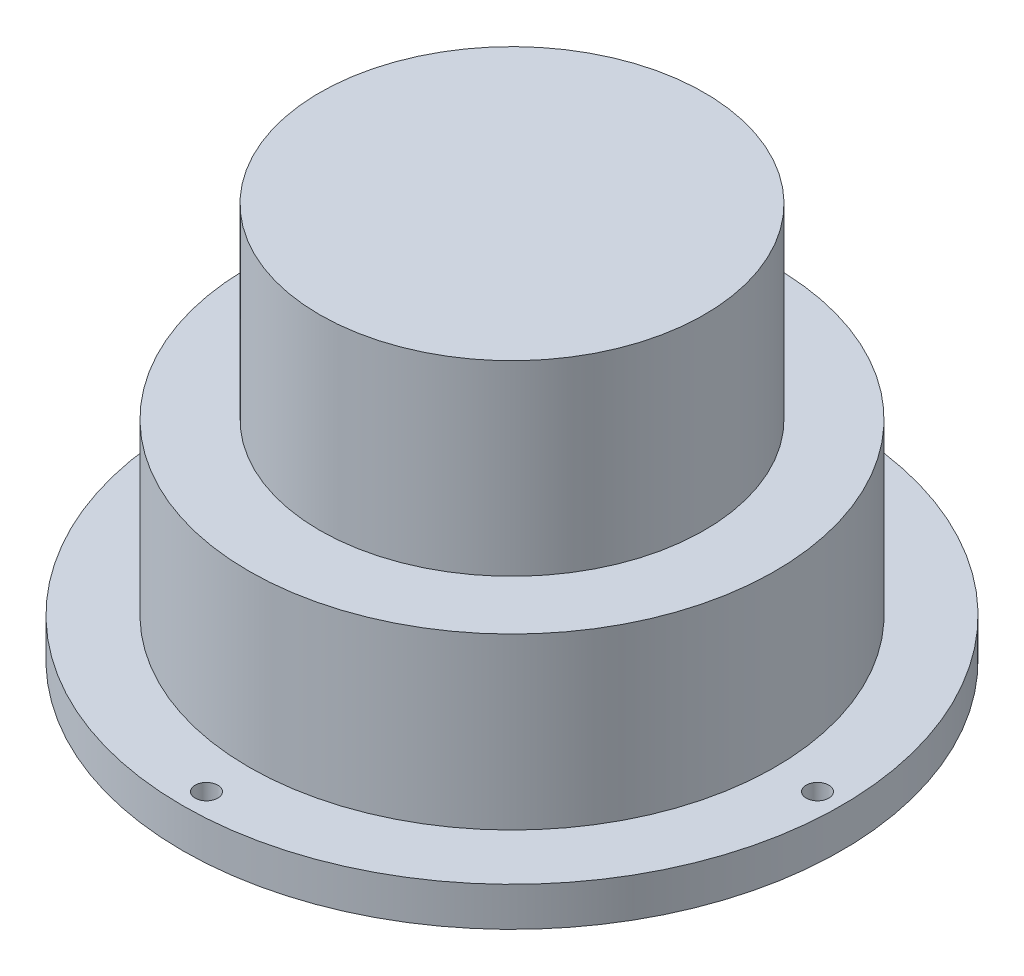
from build123d import *

# Parameters (mm, degrees)
SKETCH1_R           = 58.25
BOSS_EXTRUDE1_DEPTH = 6.9
SKETCH2_R           = 2
CUT_EXTRUDE1_DEPTH  = 6.9
SKETCH3_R           = 46.5
BOSS_EXTRUDE2_DEPTH = 30
SKETCH4_R           = 34
BOSS_EXTRUDE3_DEPTH = 33


with BuildPart() as part:
    # Sketch1 → Boss-Extrude1 (new body)
    with BuildSketch(Plane(origin=(0, 0, 0), x_dir=(1, 0, 0), z_dir=(0, 1, 0))):
        with Locations(Location((0, 0, 0), (0, 0, 90))):
            Circle(SKETCH1_R)
    extrude(amount=BOSS_EXTRUDE1_DEPTH)

    # Sketch2 → Cut-Extrude1 (cut)
    with BuildSketch(Plane(origin=(0, 6.9, 0), x_dir=(1, 0, 0), z_dir=(0, 1, 0))):
        with Locations(Location((0, 54, 0), (0, 0, 270))):
            Circle(SKETCH2_R)
        with Locations(Location((-54, 0, 0), (0, 0, 270))):
            Circle(SKETCH2_R)
        with Locations(Location((0, -54, 0), (0, 0, 270))):
            Circle(SKETCH2_R)
        with Locations(Location((54, 0, 0), (0, 0, 270))):
            Circle(SKETCH2_R)
    extrude(amount=-CUT_EXTRUDE1_DEPTH, mode=Mode.SUBTRACT)

    # Sketch3 → Boss-Extrude2 (add)
    with BuildSketch(Plane(origin=(0, 6.9, 0), x_dir=(1, 0, 0), z_dir=(0, 1, 0))):
        with Locations(Location((0, 0, 0), (0, 0, 270))):
            Circle(SKETCH3_R)
    extrude(amount=BOSS_EXTRUDE2_DEPTH)

    # Sketch4 → Boss-Extrude3 (add)
    with BuildSketch(Plane(origin=(0, 36.9, 0), x_dir=(1, 0, 0), z_dir=(0, 1, 0))):
        with Locations(Location((0, 0, 0), (0, 0, 270))):
            Circle(SKETCH4_R)
    extrude(amount=BOSS_EXTRUDE3_DEPTH)


solid = part.part
